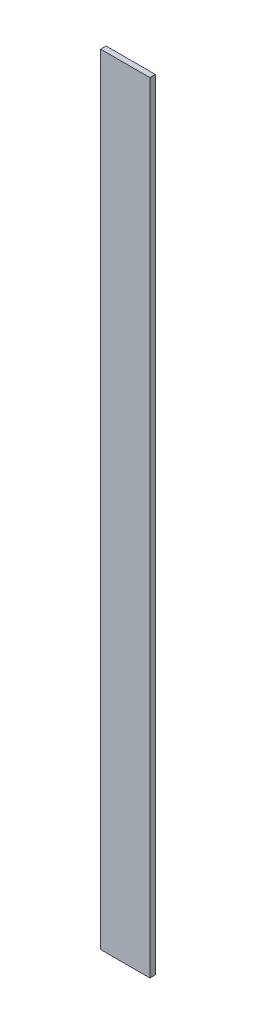
from build123d import *

# Parameters (mm, degrees)
SKETCH1_W           = 28.4
SKETCH1_H           = 450
BOSS_EXTRUDE1_DEPTH = 3.175


with BuildPart() as part:
    # Sketch1 → Boss-Extrude1 (new body)
    with BuildSketch(Plane.XY):
        with Locations((14.2, 225)):
            Rectangle(SKETCH1_W, SKETCH1_H)
    extrude(amount=BOSS_EXTRUDE1_DEPTH)


solid = part.part
